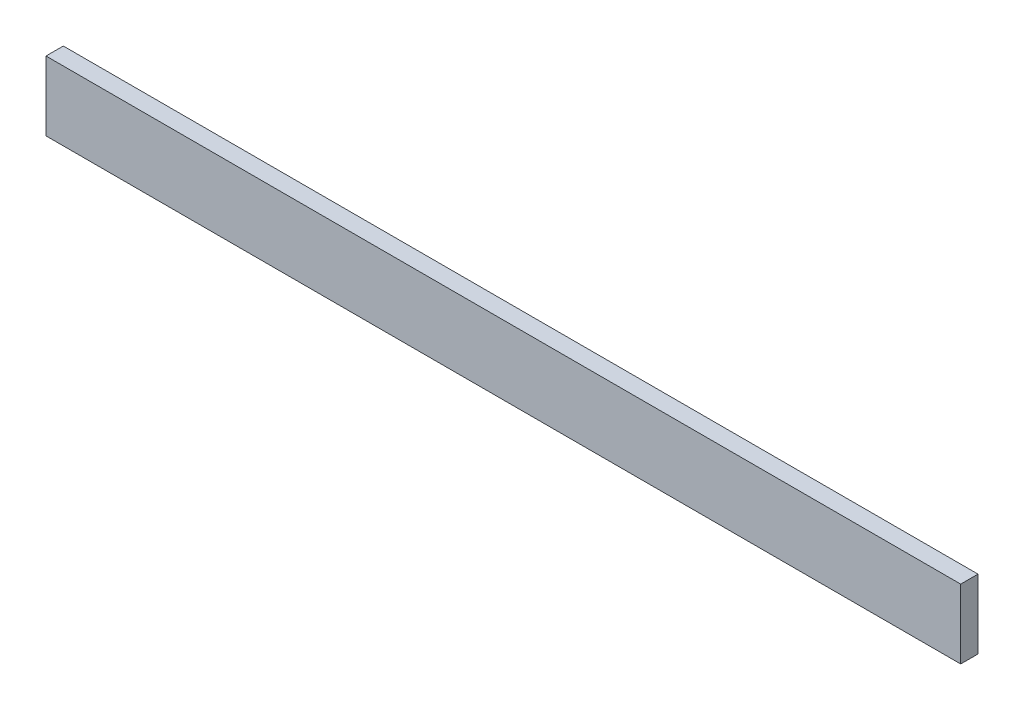
from build123d import *

# Parameters (mm, degrees)
SKETCH1_W           = 671.5125
SKETCH1_H           = 50.8
BOSS_EXTRUDE1_DEPTH = 12.7


with BuildPart() as part:
    # Sketch1 → Boss-Extrude1 (new body)
    with BuildSketch(Plane.XY):
        Rectangle(SKETCH1_W, SKETCH1_H)
    extrude(amount=BOSS_EXTRUDE1_DEPTH)


solid = part.part
